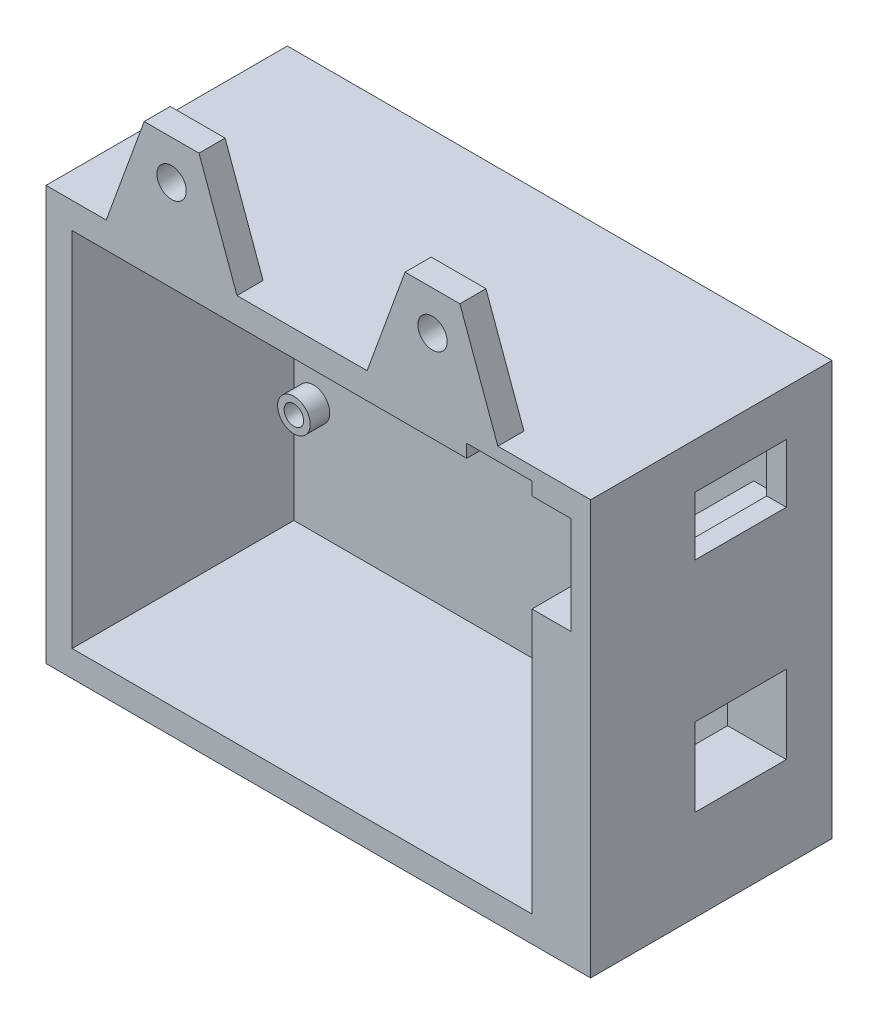
from build123d import *

# Parameters (mm, degrees)
SKETCH_1_W          = 83.5
SKETCH_1_H          = 63.5
SKETCH_1_R          = 1.5
EXTRUDE_1_DEPTH     = 3
EXTRUDE_START       = 3
EXTRUDE_2_DEPTH     = 15
EXTRUDE_START_2     = 18
EXTRUDE_3_DEPTH     = 19
SKETCH_1_5_W        = 3
SKETCH_1_5_H        = 9
EXTRUDE_6_DEPTH     = 4
SKETCH_6_R          = 2.25
EXTRUDE_7_DEPTH     = 4
SKETCH_7_W          = 3
SKETCH_7_H          = 9
SKETCH_7_W_2        = 9
SKETCH_7_H_2        = 12
EXTRUDE_8_DEPTH     = 16
SKETCH_8_W          = 10
SKETCH_8_H          = 2
CUT_EXTRUDE_1_DEPTH = 34
SKETCH_9_R          = 2.5
SKETCH_9_R_2        = 1.5
EXTRUDE_17_DEPTH    = 3


with BuildPart() as part:
    # 草图1 → 凸台-拉伸1 (new body)
    with BuildSketch(Plane.XY):
        with Locations((2.5, 0)):
            Rectangle(SKETCH_1_W, SKETCH_1_H)
        with Locations((21.25, -24.75)):
            Circle(SKETCH_1_R, mode=Mode.SUBTRACT)
        with Locations((21.25, 24.75)):
            Circle(SKETCH_1_R, mode=Mode.SUBTRACT)
        with Locations((-32.25, -10.75)):
            Circle(SKETCH_1_R, mode=Mode.SUBTRACT)
    extrude(amount=EXTRUDE_1_DEPTH)

    # 草图1<3> → 凸台-拉伸2 (add)
    with BuildSketch(Plane.XY.offset(EXTRUDE_START)):
        Polygon((35.25, -27.75), (-35.25, -27.75), (-35.25, 27.75), (41.25, 27.75), (41.25, 24.75), (44.25, 24.75), (44.25, 31.75), (-39.25, 31.75), (-39.25, -31.75), (44.25, -31.75), (44.25, -17.75), (35.25, -17.75), align=None)
        Polygon((35.25, 12.75), (35.25, -5.75), (44.25, -5.75), (44.25, 15.75), (41.25, 15.75), (41.25, 12.75), align=None)
    extrude(amount=EXTRUDE_2_DEPTH)

    # 草图1<4> → 凸台-拉伸3 (add)
    with BuildSketch(Plane.XY.offset(EXTRUDE_START_2)):
        Polygon((35.25, -27.75), (-35.25, -27.75), (-35.25, 27.75), (41.25, 27.75), (41.25, 24.75), (44.25, 24.75), (44.25, 31.75), (-39.25, 31.75), (-39.25, -31.75), (44.25, -31.75), (44.25, -17.75), (35.25, -17.75), align=None)
        Polygon((35.25, 12.75), (35.25, -5.75), (44.25, -5.75), (44.25, 15.75), (41.25, 15.75), (41.25, 12.75), align=None)
    extrude(amount=EXTRUDE_3_DEPTH)

    # 草图1<5> → 凸台-拉伸6 (add)
    with BuildSketch(Plane.XY.offset(EXTRUDE_START)):
        with Locations((42.75, 20.25)):
            Rectangle(SKETCH_1_5_W, SKETCH_1_5_H)
        Polygon((35.25, -5.75), (35.25, -17.75), (41.25, -17.75), (44.25, -17.75), (44.25, -5.75), (41.25, -5.75), align=None)
    extrude(amount=EXTRUDE_6_DEPTH)

    # 草图6 → 凸台-拉伸7 (add)
    # profile 1 of 2: a face of its own
    with BuildSketch(Plane.XY.offset(37)):
        Polygon((30.024768978, 31.75), (24.201245229, 47.75), (15.798754771, 47.75), (9.975231022, 31.75), align=None)
        with Locations((20, 41.75)):
            Circle(SKETCH_6_R, mode=Mode.SUBTRACT)
    # profile 2 of 2: a face of its own
    with BuildSketch(Plane.XY.offset(37)):
        Polygon((-24.201245229, 47.75), (-15.798754771, 47.75), (-9.975231022, 31.75), (-30.024768978, 31.75), align=None)
        with Locations((-20, 41.75)):
            Circle(SKETCH_6_R, mode=Mode.SUBTRACT)
    extrude(amount=-EXTRUDE_7_DEPTH)

    # 草图7 → 凸台-拉伸8 (add)
    with BuildSketch(Plane.XY.offset(37)):
        with Locations((42.75, 20.25)):
            Rectangle(SKETCH_7_W, SKETCH_7_H)
        with Locations((39.75, -11.75)):
            Rectangle(SKETCH_7_W_2, SKETCH_7_H_2)
    extrude(amount=-EXTRUDE_8_DEPTH)

    # 草图8 → 切除-拉伸1 (cut)
    with BuildSketch(Plane.XY.offset(37)):
        with Locations((30.25, 28.75)):
            Rectangle(SKETCH_8_W, SKETCH_8_H)
    extrude(amount=-CUT_EXTRUDE_1_DEPTH, mode=Mode.SUBTRACT)

    # 草图9 → 凸台-拉伸17 (add)
    # profile 1 of 3: a face of its own
    with BuildSketch(Plane.XY.offset(3)):
        with Locations((-32.25, -10.75)):
            Circle(SKETCH_9_R)
        with Locations((-32.25, -10.75)):
            Circle(SKETCH_9_R_2, mode=Mode.SUBTRACT)
    # profile 2 of 3: a face of its own
    with BuildSketch(Plane.XY.offset(3)):
        with Locations((21.25, 24.75)):
            Circle(SKETCH_9_R)
        with Locations((21.25, 24.75)):
            Circle(SKETCH_9_R_2, mode=Mode.SUBTRACT)
    # profile 3 of 3: a face of its own
    with BuildSketch(Plane.XY.offset(3)):
        with Locations((21.25, -24.75)):
            Circle(SKETCH_9_R)
        with Locations((21.25, -24.75)):
            Circle(SKETCH_9_R_2, mode=Mode.SUBTRACT)
    extrude(amount=EXTRUDE_17_DEPTH)


solid = part.part
